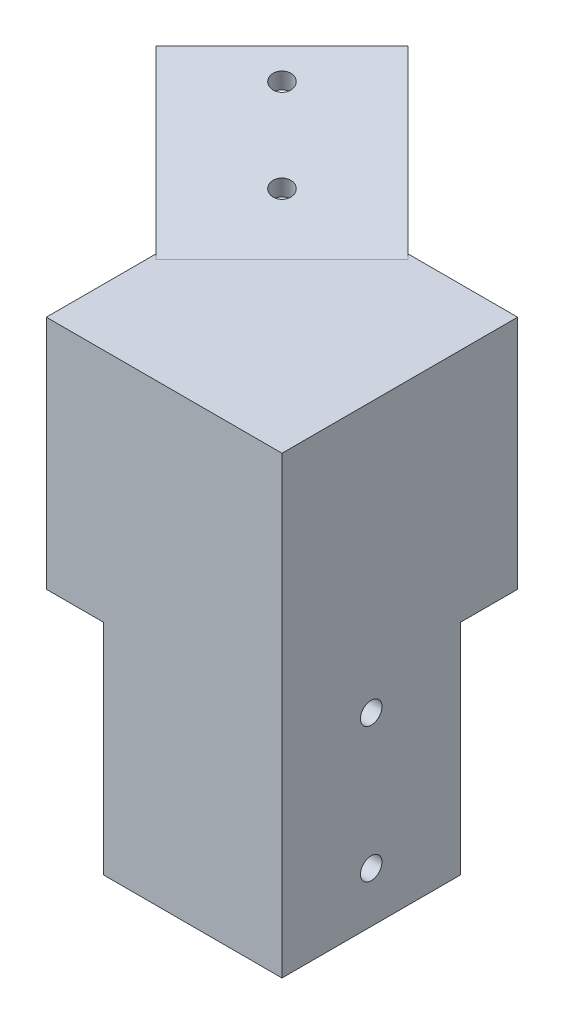
from build123d import *

# Parameters (mm, degrees)
SKETCH_4_W          = 26.5
SKETCH_4_H          = 26.5
SKETCH_4_W_2        = 20.5
SKETCH_4_H_2        = 20.5
EXTRUDE_1_DEPTH     = 50
EXTRUDE_2_DEPTH     = 50
EXTRUDE_3_DEPTH     = 17.5
SKETCH_4_2_W        = 20.5
SKETCH_4_2_H        = 20.5
CUT_EXTRUDE_1_DEPTH = 82.971372719
CUT_EXTRUDE_2_DEPTH = 82.971372719
SKETCH_7_R          = 1.5
CUT_EXTRUDE_3_DEPTH = 93.625217786
SKETCH_8_R          = 1.6
CUT_EXTRUDE_4_DEPTH = 76.350501248


with BuildPart() as part:
    # 草图4 → 凸台-拉伸1 (new body)
    with BuildSketch(Plane(origin=(0, 0, 0), x_dir=(1, 0, 0), z_dir=(0, 1, 0))):
        Rectangle(SKETCH_4_W, SKETCH_4_H)
        Rectangle(SKETCH_4_W_2, SKETCH_4_H_2, mode=Mode.SUBTRACT)
    extrude(amount=-EXTRUDE_1_DEPTH)

    # 草图5 → 凸台-拉伸2 (add)
    with BuildSketch(Plane(origin=(0, 0, 0), x_dir=(0.7254762501100117, 0.21764287503300356, -0.6529286250990104), z_dir=(0.6882472016116853, -0.22941573387056186, 0.6882472016116854))):
        Polygon((15.877292577, 9.951712437), (-9.951712437, 15.877292577), (-15.877292577, -9.951712437), (9.951712437, -15.877292577), align=None)
        Polygon((-12.28243388, -7.698494526), (-7.698494526, 12.28243388), (12.28243388, 7.698494526), (7.698494526, -12.28243388), align=None, mode=Mode.SUBTRACT)
    extrude(amount=-EXTRUDE_2_DEPTH)

    # 草图6 → 凸台-拉伸3 (add, symmetric)
    with BuildSketch(Plane(origin=(0, 0, 0), x_dir=(1, 0, 0), z_dir=(0, 1, 0))):
        Polygon((13.25, -13.25), (-21.75, -13.25), (-21.75, 3.011670299), (-3.011670299, 21.75), (13.25, 21.75), align=None)
    extrude(amount=EXTRUDE_3_DEPTH, both=True)

    # 草图4<2> → 切除-拉伸1 (cut, through all)
    with BuildSketch(Plane(origin=(0, 0, 0), x_dir=(1, 0, 0), z_dir=(0, 1, 0))):
        Rectangle(SKETCH_4_2_W, SKETCH_4_2_H)
    extrude(amount=-CUT_EXTRUDE_1_DEPTH, mode=Mode.SUBTRACT)

    # 草图5<2> → 切除-拉伸2 (cut, through all)
    with BuildSketch(Plane(origin=(0, 0, 0), x_dir=(0.7254762501100117, 0.21764287503300356, -0.6529286250990104), z_dir=(0.6882472016116853, -0.22941573387056186, 0.6882472016116854))):
        Polygon((12.28243388, 7.698494526), (-7.698494526, 12.28243388), (-12.28243388, -7.698494526), (7.698494526, -12.28243388), align=None)
    extrude(amount=-CUT_EXTRUDE_2_DEPTH, mode=Mode.SUBTRACT)

    # 草图7 → 切除-拉伸3 (cut, through all)
    with BuildSketch(Plane(origin=(2.14943383, 12.89660298, 2.14943383), x_dir=(0.9867543820659302, -0.16001422411879954, -0.026669037353133265), z_dir=(0.1622214211307626, 0.9733285267845754, 0.1622214211307625))):
        with Locations((-31.386862461, 32.246935744)):
            Circle(SKETCH_7_R)
        with Locations((-20.924574974, 21.497957163)):
            Circle(SKETCH_7_R)
    extrude(amount=-CUT_EXTRUDE_3_DEPTH, mode=Mode.SUBTRACT)

    # 草图8 → 切除-拉伸4 (cut, through all)
    with BuildSketch(Plane.ZY.offset(13.25)):
        with Locations((0, -22.5)):
            Circle(SKETCH_8_R)
        with Locations((0, -42.5)):
            Circle(SKETCH_8_R)
    extrude(amount=-CUT_EXTRUDE_4_DEPTH, mode=Mode.SUBTRACT)


solid = part.part
